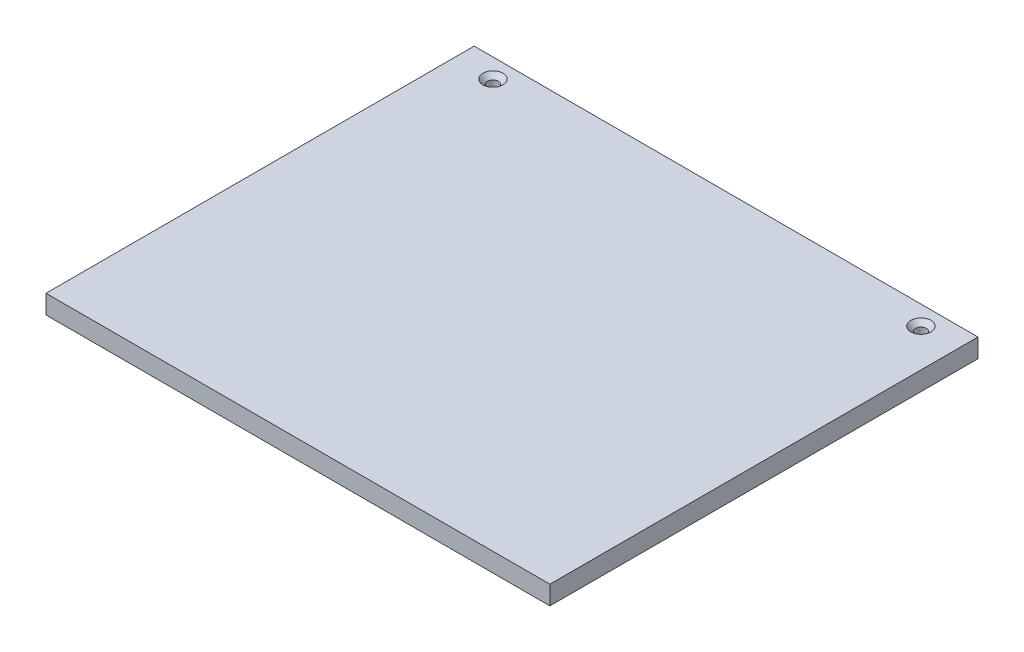
from build123d import *

# Parameters (mm, degrees)
SKETCH1_W                                       = 158
SKETCH1_H                                       = 134.25
BOSS_EXTRUDE1_DEPTH                             = 5.9
CSK_FOR_M3_FLAT_HEAD_MACHINE_SCREW1_D           = 3.4
CSK_FOR_M3_FLAT_HEAD_MACHINE_SCREW1_DEPTH       = 10
CSK_FOR_M3_FLAT_HEAD_MACHINE_SCREW1_CSINK_D     = 6.3
CSK_FOR_M3_FLAT_HEAD_MACHINE_SCREW1_CSINK_ANGLE = 90
CSK_FOR_M3_FLAT_HEAD_MACHINE_SCREW1_TIP         = 1.021463052


with BuildPart() as part:
    # Sketch1 → Boss-Extrude1 (new body)
    with BuildSketch(Plane(origin=(0, 0, 0), x_dir=(1, 0, 0), z_dir=(0, 1, 0))):
        Rectangle(SKETCH1_W, SKETCH1_H)
    extrude(amount=BOSS_EXTRUDE1_DEPTH)

    # CSK for M3 Flat Head Machine Screw1
    with Locations(Plane(origin=(0, 5.9, 0), x_dir=(1, 0, 0), z_dir=(0, 1, 0))):
        with Locations((-67.1, 61.125), (67.1, 61.125)):
            CounterSinkHole(CSK_FOR_M3_FLAT_HEAD_MACHINE_SCREW1_D / 2, CSK_FOR_M3_FLAT_HEAD_MACHINE_SCREW1_CSINK_D / 2, depth=CSK_FOR_M3_FLAT_HEAD_MACHINE_SCREW1_DEPTH, counter_sink_angle=CSK_FOR_M3_FLAT_HEAD_MACHINE_SCREW1_CSINK_ANGLE)
            with Locations((0, 0, -(CSK_FOR_M3_FLAT_HEAD_MACHINE_SCREW1_DEPTH + CSK_FOR_M3_FLAT_HEAD_MACHINE_SCREW1_TIP / 2))):  # 118° drill point
                Cone(0, CSK_FOR_M3_FLAT_HEAD_MACHINE_SCREW1_D / 2, CSK_FOR_M3_FLAT_HEAD_MACHINE_SCREW1_TIP, mode=Mode.SUBTRACT)


solid = part.part
